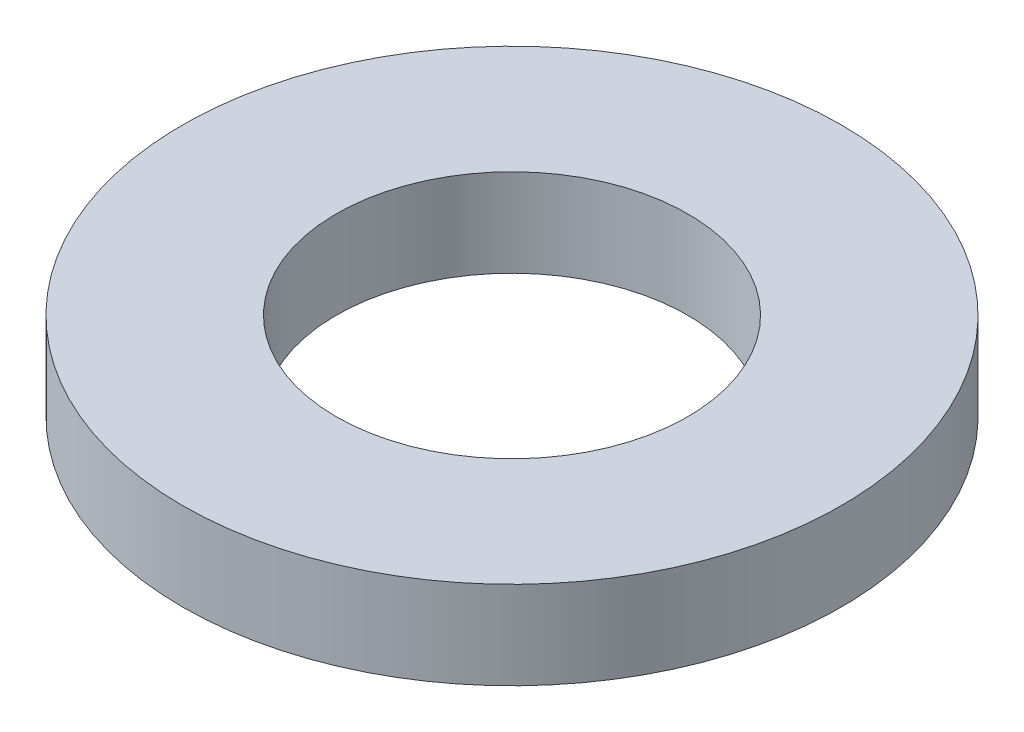
from build123d import *

# Parameters (mm, degrees)
SKETCH1_R           = 11.90625
SKETCH1_R_2         = 6.35
BOSS_EXTRUDE1_DEPTH = 3.175


with BuildPart() as part:
    # Sketch1 → Boss-Extrude1 (new body)
    with BuildSketch(Plane(origin=(0, 0, 0), x_dir=(1, 0, 0), z_dir=(0, 1, 0))):
        with Locations(Location((0, 0, 0), (0, 0, 270))):
            Circle(SKETCH1_R)
        with Locations(Location((0, 0, 0), (0, 0, 270))):
            Circle(SKETCH1_R_2, mode=Mode.SUBTRACT)
    extrude(amount=BOSS_EXTRUDE1_DEPTH)


solid = part.part
